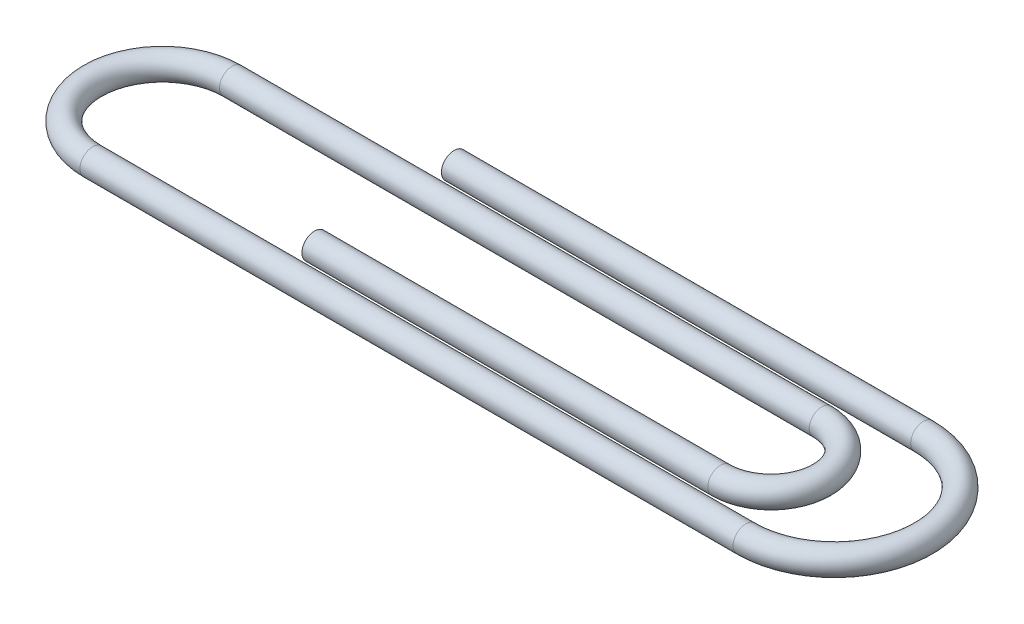
from build123d import *

# Parameters (mm, degrees)
CROSS_SECTION_R = 0.5


with BuildPart() as part:
    # Sweep1: sweep along a path in Path
    with BuildLine(Plane(origin=(0, 0, 0), x_dir=(1, 0, 0), z_dir=(0, 1, 0))) as sweep1_path:
        Line((0, 0), (18.5, 0))
        ThreePointArc((18.5, 0), (22, -3.5), (18.5, -7))
        Line((18.5, -7), (-7.25, -7))
        ThreePointArc((-7.25, -7), (-10, -4.25), (-7.25, -1.5))
        Line((-7.25, -1.5), (16, -1.5))
        ThreePointArc((16, -1.5), (18, -3.5), (16, -5.5))
        Line((16, -5.5), (0, -5.5))
    # Cross-Section → Sweep1 (sweep)
    with BuildSketch(Plane(origin=(0, 0, 0), x_dir=(0, 0, -1), z_dir=(1, 0, 0))):
        Circle(CROSS_SECTION_R)
    sweep(path=sweep1_path.line)


solid = part.part
